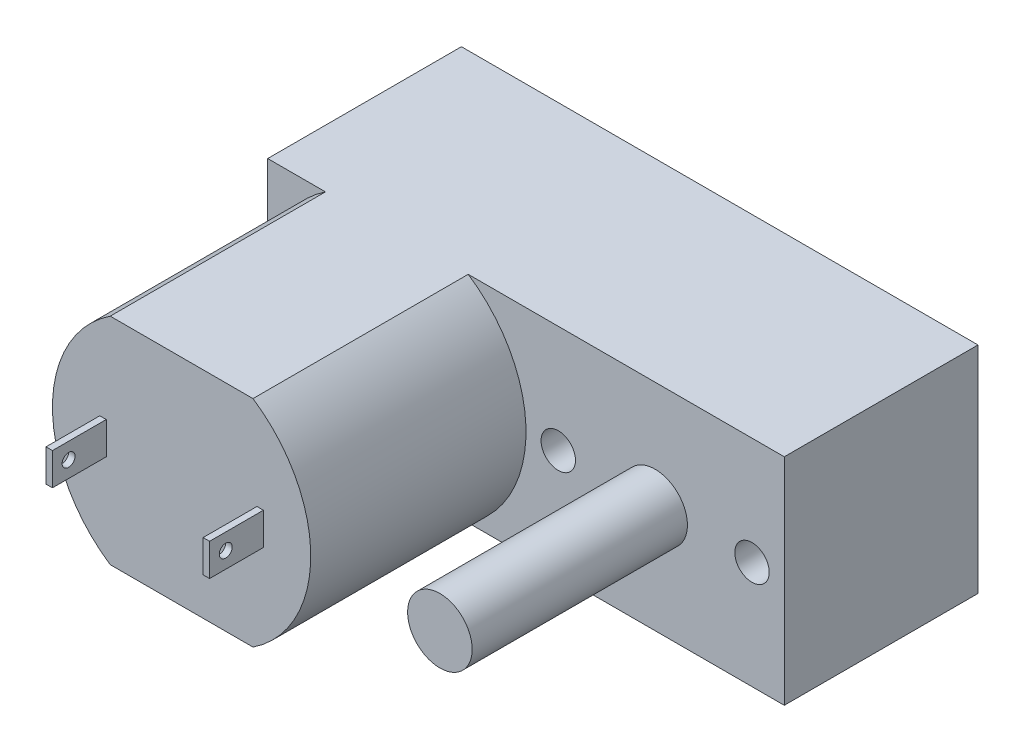
from build123d import *

# Parameters (mm, degrees)
SKETCH_1_W          = 12
SKETCH_1_H          = 10
EXTRUDE_1_DEPTH     = 19
SKETCH_2_OUTSIDE_W  = 18.92
SKETCH_2_OUTSIDE_H  = 16.92
SKETCH_2_OUTSIDE_R  = 6
CUT_EXTRUDE_1_DEPTH = 19
SKETCH_3_W          = 24
SKETCH_3_H          = 10
EXTRUDE_2_DEPTH     = 9
SKETCH_4_R          = 1.5
EXTRUDE_3_DEPTH     = 10
SKETCH_9_R          = 0.8
CUT_EXTRUDE_2_DEPTH = 3
SKETCH_10_W         = 0.3
SKETCH_10_H         = 1.5
EXTRUDE_5_DEPTH     = 2.5
SKETCH_12_R         = 0.3
CUT_EXTRUDE_3_DEPTH = 7.6


with BuildPart() as part:
    # 草图1 → 凸台-拉伸1 (new body)
    with BuildSketch(Plane.XY):
        with Locations((6, 5)):
            Rectangle(SKETCH_1_W, SKETCH_1_H)
    extrude(amount=EXTRUDE_1_DEPTH)

    # 草图2 outside → 切除-拉伸1 (cut)
    with BuildSketch(Plane.XY):
        with Locations((6, 5)):
            Rectangle(SKETCH_2_OUTSIDE_W, SKETCH_2_OUTSIDE_H)
        with Locations((6, 5)):
            Circle(SKETCH_2_OUTSIDE_R, mode=Mode.SUBTRACT)
    extrude(amount=CUT_EXTRUDE_1_DEPTH, mode=Mode.SUBTRACT)

    # 草图3 → 凸台-拉伸2 (add)
    with BuildSketch(Plane.XY):
        with Locations((12, 5)):
            Rectangle(SKETCH_3_W, SKETCH_3_H)
    extrude(amount=EXTRUDE_2_DEPTH)

    # 草图4 → 凸台-拉伸3 (add)
    with BuildSketch(Plane.XY.offset(9)):
        with Locations(Location((18, 5, 0), (0, 0, 180))):
            Circle(SKETCH_4_R)
    extrude(amount=EXTRUDE_3_DEPTH)

    # 草图9 → 切除-拉伸2 (cut)
    with BuildSketch(Plane.XY.offset(9)):
        with Locations((13.5, 5)):
            Circle(SKETCH_9_R)
        with Locations((22.5, 5)):
            Circle(SKETCH_9_R)
    extrude(amount=-CUT_EXTRUDE_2_DEPTH, mode=Mode.SUBTRACT)

    # 草图10 → 凸台-拉伸5 (add)
    with BuildSketch(Plane.XY.offset(19)):
        with Locations((2.35, 5)):
            Rectangle(SKETCH_10_W, SKETCH_10_H)
        with Locations((9.65, 5)):
            Rectangle(SKETCH_10_W, SKETCH_10_H)
    extrude(amount=EXTRUDE_5_DEPTH)

    # 草图12 → 切除-拉伸3 (cut)
    with BuildSketch(Plane.ZY.offset(-2.2)):
        with Locations(Location((20.75, 5, 0), (0, 0, 270))):
            Circle(SKETCH_12_R)
    extrude(amount=-CUT_EXTRUDE_3_DEPTH, mode=Mode.SUBTRACT)


solid = part.part
